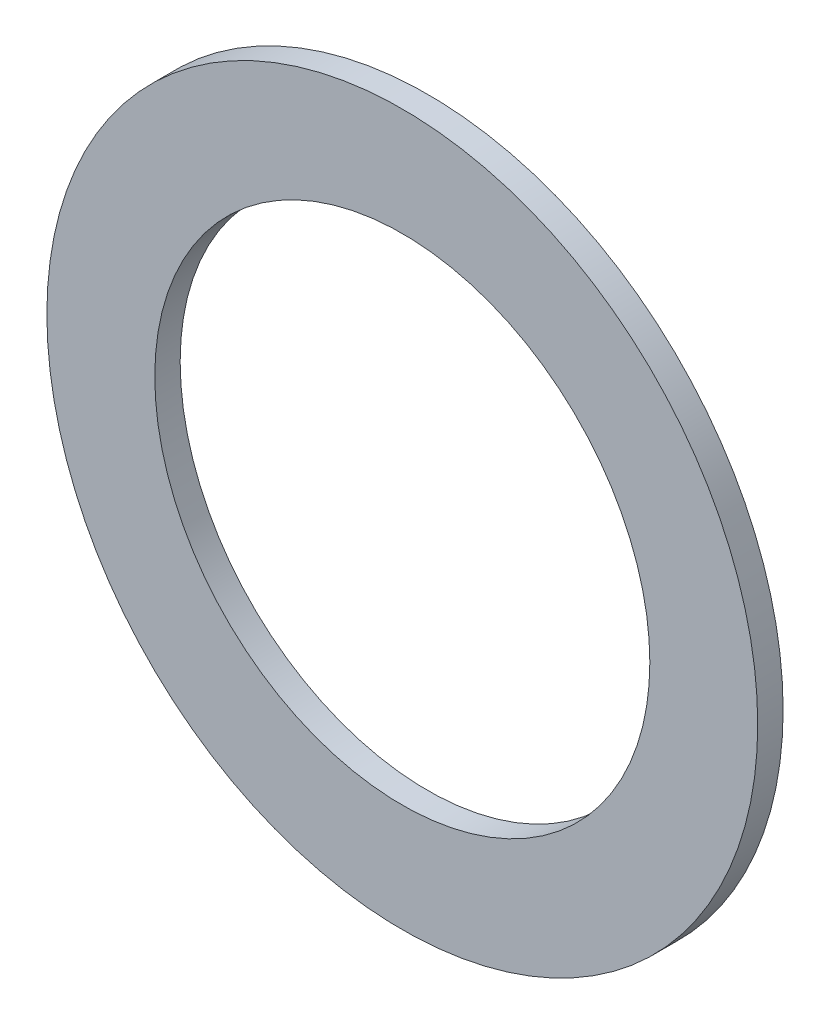
from build123d import *

# Parameters (mm, degrees)
ESQUISSE1_R      = 14
ESQUISSE1_R_2    = 9.75
EXTRUSION1_DEPTH = 1


with BuildPart() as part:
    # Esquisse1 → Extrusion1 (new body)
    with BuildSketch(Plane.XY):
        Circle(ESQUISSE1_R)
        Circle(ESQUISSE1_R_2, mode=Mode.SUBTRACT)
    extrude(amount=EXTRUSION1_DEPTH)


solid = part.part
